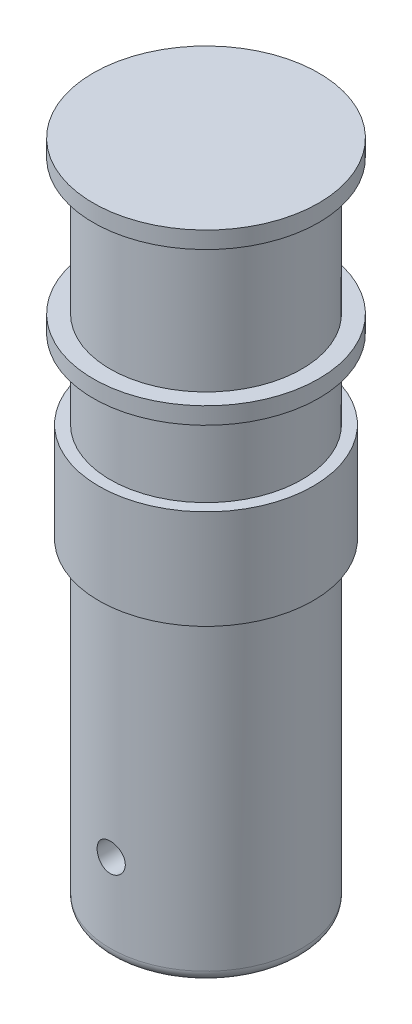
from build123d import *

# Parameters (mm, degrees)
FILLET1_R = 1
SKETCH3_W = 1.25
SKETCH3_H = 8.5


with BuildPart() as part:
    # Sketch1 → Revolve1 (revolve)
    with BuildSketch(Plane.XY):
        Polygon((-8.5, -44), (-8.5, -15.8), (-9.5, -15.8), (-9.5, -7), (-8.5, -7), (-8.5, 0), (-10, 0), (-10, 1.5), (-8.5, 1.5), (-8.5, 13.5), (-10, 13.5), (-10, 15), (0, 15), (0, -30), (-4, -30), (-4, -44), align=None)
    revolve(axis=Axis((0, 15, 0), (0, -1, 0)))

    # Fillet1
    fillet1_edges = [part.edges().sort_by_distance(p)[0] for p in [
        (8.5, -44, 0),
        (4, -44, 0),
    ]]
    fillet(fillet1_edges, radius=FILLET1_R)

    # Sketch3 → M3x0.5 Tapped Hole1 (revolve, cut)
    with BuildSketch(Plane(origin=(0, -36, 0), x_dir=(0, 1, 0), z_dir=(1, 0, 0))):
        with Locations((0.625, 4.25)):
            Rectangle(SKETCH3_W, SKETCH3_H)
    revolve(axis=Axis((0, -36, -6.35), (0, 0, 1)), mode=Mode.SUBTRACT)


solid = part.part
